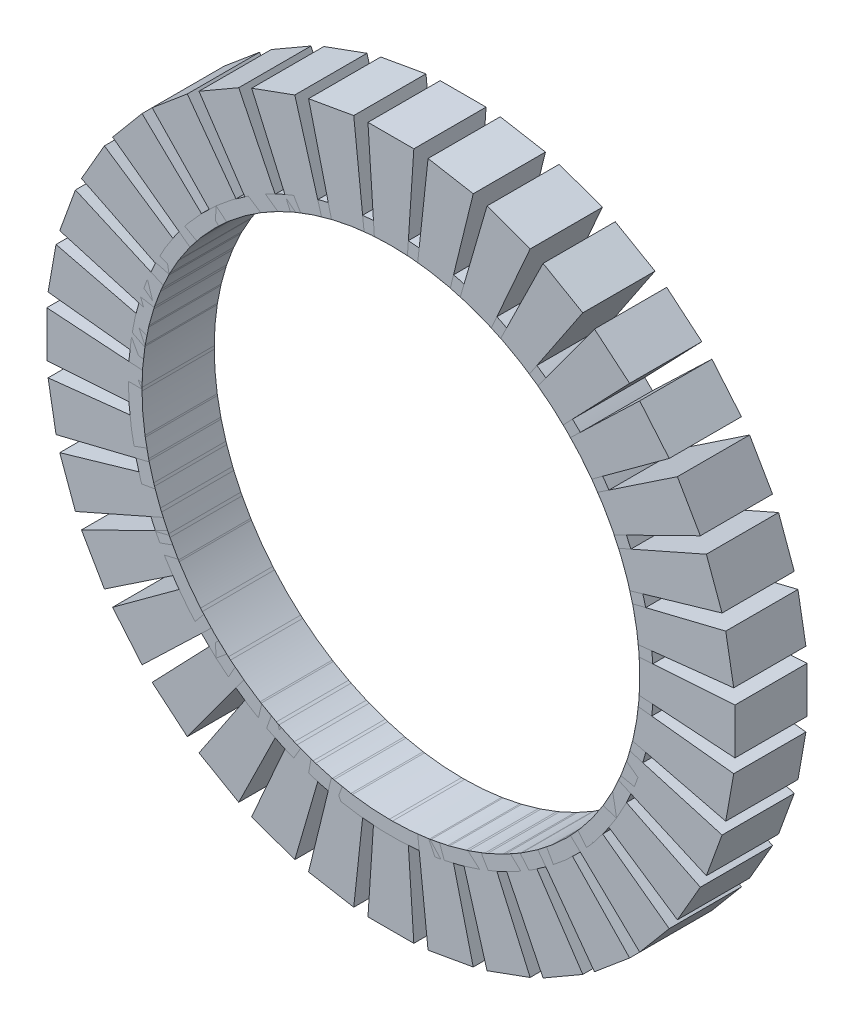
from build123d import *

# Parameters (mm, degrees)
BOSS_EXTRUDE1_DEPTH    = 4.25
BOSS_EXTRUDE1_2_DEPTH  = 4.25
BOSS_EXTRUDE1_3_DEPTH  = 4.25
BOSS_EXTRUDE1_4_DEPTH  = 4.25
BOSS_EXTRUDE1_5_DEPTH  = 4.25
BOSS_EXTRUDE1_6_DEPTH  = 4.25
BOSS_EXTRUDE1_7_DEPTH  = 4.25
BOSS_EXTRUDE1_8_DEPTH  = 4.25
BOSS_EXTRUDE1_9_DEPTH  = 4.25
BOSS_EXTRUDE1_10_DEPTH = 4.25
BOSS_EXTRUDE1_11_DEPTH = 4.25
BOSS_EXTRUDE1_12_DEPTH = 4.25
BOSS_EXTRUDE1_13_DEPTH = 4.25
BOSS_EXTRUDE1_14_DEPTH = 4.25
BOSS_EXTRUDE1_15_DEPTH = 4.25
BOSS_EXTRUDE1_16_DEPTH = 4.25
BOSS_EXTRUDE1_17_DEPTH = 4.25
BOSS_EXTRUDE1_18_DEPTH = 4.25
BOSS_EXTRUDE1_19_DEPTH = 4.25
BOSS_EXTRUDE1_20_DEPTH = 4.25
BOSS_EXTRUDE1_21_DEPTH = 4.25
BOSS_EXTRUDE1_22_DEPTH = 4.25
BOSS_EXTRUDE1_23_DEPTH = 4.25
BOSS_EXTRUDE1_24_DEPTH = 4.25
BOSS_EXTRUDE1_25_DEPTH = 4.25
BOSS_EXTRUDE1_26_DEPTH = 4.25
BOSS_EXTRUDE1_27_DEPTH = 4.25
BOSS_EXTRUDE1_28_DEPTH = 4.25
BOSS_EXTRUDE1_29_DEPTH = 4.25
BOSS_EXTRUDE1_30_DEPTH = 4.25
BOSS_EXTRUDE1_31_DEPTH = 4.25
BOSS_EXTRUDE1_32_DEPTH = 4.25
BOSS_EXTRUDE1_33_DEPTH = 4.25
BOSS_EXTRUDE1_34_DEPTH = 4.25
BOSS_EXTRUDE1_35_DEPTH = 4.25
BOSS_EXTRUDE1_36_DEPTH = 4.25
SKETCH2_R              = 30.9
SKETCH2_R_2            = 29.3
BOSS_EXTRUDE2_DEPTH    = 4.25


with BuildPart() as part:
    # Sketch1 → Boss-Extrude1 (new, symmetric)
    with BuildSketch(Plane.XY):
        with BuildLine():
            Line((-2.7, 40.5), (2.7, 40.5))
            Line((2.7, 40.5), (1.949007008, 29.235105125))
            ThreePointArc((1.949007008, 29.235105125), (0, 29.3), (-1.949007008, 29.235105125))
            Line((-1.949007008, 29.235105125), (-2.7, 40.5))
        make_face()
    extrude(amount=BOSS_EXTRUDE1_DEPTH, both=True)


with BuildPart() as body_2:
    # Sketch1 → Boss-Extrude1 2 (new, symmetric)
    with BuildSketch(Plane.XY):
        with BuildLine():
            Line((3.157225516, 29.129399703), (4.373770262, 40.353564077))
            Line((4.373770262, 40.353564077), (9.691732129, 39.415863917))
            Line((9.691732129, 39.415863917), (6.996019941, 28.452516672))
            ThreePointArc((6.996019941, 28.452516672), (5.087891606, 28.854867163), (3.157225516, 29.129399703))
        make_face()
    extrude(amount=BOSS_EXTRUDE1_2_DEPTH, both=True)


with BuildPart() as body_3:
    # Sketch1 → Boss-Extrude1 3 (new, symmetric)
    with BuildSketch(Plane.XY):
        with BuildLine():
            Line((8.167527341, 28.13861221), (11.314645729, 38.981005529))
            Line((11.314645729, 38.981005529), (16.388985881, 37.134096755))
            Line((16.388985881, 37.134096755), (11.830462349, 26.805412898))
            ThreePointArc((11.830462349, 26.805412898), (10.021190199, 27.532993789), (8.167527341, 28.13861221))
        make_face()
    extrude(amount=BOSS_EXTRUDE1_3_DEPTH, both=True)


with BuildPart() as body_4:
    # Sketch1 → Boss-Extrude1 4 (new, symmetric)
    with BuildSketch(Plane.XY):
        with BuildLine():
            Line((12.929662981, 26.292847225), (17.91173141, 36.424028853))
            Line((17.91173141, 36.424028853), (22.58826859, 33.724028853))
            Line((22.58826859, 33.724028853), (16.305442144, 24.343840217))
            ThreePointArc((16.305442144, 24.343840217), (14.65, 25.374544331), (12.929662981, 26.292847225))
        make_face()
    extrude(amount=BOSS_EXTRUDE1_4_DEPTH, both=True)


with BuildPart() as body_5:
    # Sketch1 → Boss-Extrude1 5 (new, symmetric)
    with BuildSketch(Plane.XY):
        with BuildLine():
            Line((17.298937354, 23.648187381), (23.964578196, 32.760326492))
            Line((23.964578196, 32.760326492), (28.101218189, 29.2892734))
            Line((28.101218189, 29.2892734), (20.284989331, 21.142592269))
            ThreePointArc((20.284989331, 21.142592269), (18.833676964, 22.445102183), (17.298937354, 23.648187381))
        make_face()
    extrude(amount=BOSS_EXTRUDE1_5_DEPTH, both=True)


with BuildPart() as body_6:
    # Sketch1 → Boss-Extrude1 6 (new, symmetric)
    with BuildSketch(Plane.XY):
        with BuildLine():
            Line((21.142592269, 20.284989331), (29.2892734, 28.101218189))
            Line((29.2892734, 28.101218189), (32.760326492, 23.964578196))
            Line((32.760326492, 23.964578196), (23.648187381, 17.298937354))
            ThreePointArc((23.648187381, 17.298937354), (22.445102183, 18.833676964), (21.142592269, 20.284989331))
        make_face()
    extrude(amount=BOSS_EXTRUDE1_6_DEPTH, both=True)


with BuildPart() as body_7:
    # Sketch1 → Boss-Extrude1 7 (new, symmetric)
    with BuildSketch(Plane.XY):
        with BuildLine():
            Line((24.343840217, 16.305442144), (33.724028853, 22.58826859))
            Line((33.724028853, 22.58826859), (36.424028853, 17.91173141))
            Line((36.424028853, 17.91173141), (26.292847225, 12.929662981))
            ThreePointArc((26.292847225, 12.929662981), (25.374544331, 14.65), (24.343840217, 16.305442144))
        make_face()
    extrude(amount=BOSS_EXTRUDE1_7_DEPTH, both=True)


with BuildPart() as body_8:
    # Sketch1 → Boss-Extrude1 8 (new, symmetric)
    with BuildSketch(Plane.XY):
        with BuildLine():
            Line((26.805412898, 11.830462349), (37.134096755, 16.388985881))
            Line((37.134096755, 16.388985881), (38.981005529, 11.314645729))
            Line((38.981005529, 11.314645729), (28.13861221, 8.167527341))
            ThreePointArc((28.13861221, 8.167527341), (27.532993789, 10.021190199), (26.805412898, 11.830462349))
        make_face()
    extrude(amount=BOSS_EXTRUDE1_8_DEPTH, both=True)


with BuildPart() as body_9:
    # Sketch1 → Boss-Extrude1 9 (new, symmetric)
    with BuildSketch(Plane.XY):
        with BuildLine():
            Line((28.452516672, 6.996019941), (39.415863917, 9.691732129))
            Line((39.415863917, 9.691732129), (40.353564077, 4.373770262))
            Line((40.353564077, 4.373770262), (29.129399703, 3.157225516))
            ThreePointArc((29.129399703, 3.157225516), (28.854867163, 5.087891606), (28.452516672, 6.996019941))
        make_face()
    extrude(amount=BOSS_EXTRUDE1_9_DEPTH, both=True)


with BuildPart() as body_10:
    # Sketch1 → Boss-Extrude1 10 (new, symmetric)
    with BuildSketch(Plane.XY):
        with BuildLine():
            Line((29.235105125, 1.949007008), (40.5, 2.7))
            Line((40.5, 2.7), (40.5, -2.7))
            Line((40.5, -2.7), (29.235105125, -1.949007008))
            ThreePointArc((29.235105125, -1.949007008), (29.3, 0), (29.235105125, 1.949007008))
        make_face()
    extrude(amount=BOSS_EXTRUDE1_10_DEPTH, both=True)


with BuildPart() as body_11:
    # Sketch1 → Boss-Extrude1 11 (new, symmetric)
    with BuildSketch(Plane.XY):
        with BuildLine():
            Line((29.129399703, -3.157225516), (40.353564077, -4.373770262))
            Line((40.353564077, -4.373770262), (39.415863917, -9.691732129))
            Line((39.415863917, -9.691732129), (28.452516672, -6.996019941))
            ThreePointArc((28.452516672, -6.996019941), (28.854867163, -5.087891606), (29.129399703, -3.157225516))
        make_face()
    extrude(amount=BOSS_EXTRUDE1_11_DEPTH, both=True)


with BuildPart() as body_12:
    # Sketch1 → Boss-Extrude1 12 (new, symmetric)
    with BuildSketch(Plane.XY):
        with BuildLine():
            Line((28.13861221, -8.167527341), (38.981005529, -11.314645729))
            Line((38.981005529, -11.314645729), (37.134096755, -16.388985881))
            Line((37.134096755, -16.388985881), (26.805412898, -11.830462349))
            ThreePointArc((26.805412898, -11.830462349), (27.532993789, -10.021190199), (28.13861221, -8.167527341))
        make_face()
    extrude(amount=BOSS_EXTRUDE1_12_DEPTH, both=True)


with BuildPart() as body_13:
    # Sketch1 → Boss-Extrude1 13 (new, symmetric)
    with BuildSketch(Plane.XY):
        with BuildLine():
            Line((26.292847225, -12.929662981), (36.424028853, -17.91173141))
            Line((36.424028853, -17.91173141), (33.724028853, -22.58826859))
            Line((33.724028853, -22.58826859), (24.343840217, -16.305442144))
            ThreePointArc((24.343840217, -16.305442144), (25.374544331, -14.65), (26.292847225, -12.929662981))
        make_face()
    extrude(amount=BOSS_EXTRUDE1_13_DEPTH, both=True)


with BuildPart() as body_14:
    # Sketch1 → Boss-Extrude1 14 (new, symmetric)
    with BuildSketch(Plane.XY):
        with BuildLine():
            Line((23.648187381, -17.298937354), (32.760326492, -23.964578196))
            Line((32.760326492, -23.964578196), (29.2892734, -28.101218189))
            Line((29.2892734, -28.101218189), (21.142592269, -20.284989331))
            ThreePointArc((21.142592269, -20.284989331), (22.445102183, -18.833676964), (23.648187381, -17.298937354))
        make_face()
    extrude(amount=BOSS_EXTRUDE1_14_DEPTH, both=True)


with BuildPart() as body_15:
    # Sketch1 → Boss-Extrude1 15 (new, symmetric)
    with BuildSketch(Plane.XY):
        with BuildLine():
            Line((20.284989331, -21.142592269), (28.101218189, -29.2892734))
            Line((28.101218189, -29.2892734), (23.964578196, -32.760326492))
            Line((23.964578196, -32.760326492), (17.298937354, -23.648187381))
            ThreePointArc((17.298937354, -23.648187381), (18.833676964, -22.445102183), (20.284989331, -21.142592269))
        make_face()
    extrude(amount=BOSS_EXTRUDE1_15_DEPTH, both=True)


with BuildPart() as body_16:
    # Sketch1 → Boss-Extrude1 16 (new, symmetric)
    with BuildSketch(Plane.XY):
        with BuildLine():
            Line((16.305442144, -24.343840217), (22.58826859, -33.724028853))
            Line((22.58826859, -33.724028853), (17.91173141, -36.424028853))
            Line((17.91173141, -36.424028853), (12.929662981, -26.292847225))
            ThreePointArc((12.929662981, -26.292847225), (14.65, -25.374544331), (16.305442144, -24.343840217))
        make_face()
    extrude(amount=BOSS_EXTRUDE1_16_DEPTH, both=True)


with BuildPart() as body_17:
    # Sketch1 → Boss-Extrude1 17 (new, symmetric)
    with BuildSketch(Plane.XY):
        with BuildLine():
            Line((11.830462349, -26.805412898), (16.388985881, -37.134096755))
            Line((16.388985881, -37.134096755), (11.314645729, -38.981005529))
            Line((11.314645729, -38.981005529), (8.167527341, -28.13861221))
            ThreePointArc((8.167527341, -28.13861221), (10.021190199, -27.532993789), (11.830462349, -26.805412898))
        make_face()
    extrude(amount=BOSS_EXTRUDE1_17_DEPTH, both=True)


with BuildPart() as body_18:
    # Sketch1 → Boss-Extrude1 18 (new, symmetric)
    with BuildSketch(Plane.XY):
        with BuildLine():
            Line((6.996019941, -28.452516672), (9.691732129, -39.415863917))
            Line((9.691732129, -39.415863917), (4.373770262, -40.353564077))
            Line((4.373770262, -40.353564077), (3.157225516, -29.129399703))
            ThreePointArc((3.157225516, -29.129399703), (5.087891606, -28.854867163), (6.996019941, -28.452516672))
        make_face()
    extrude(amount=BOSS_EXTRUDE1_18_DEPTH, both=True)


with BuildPart() as body_19:
    # Sketch1 → Boss-Extrude1 19 (new, symmetric)
    with BuildSketch(Plane.XY):
        with BuildLine():
            Line((1.949007008, -29.235105125), (2.7, -40.5))
            Line((2.7, -40.5), (-2.7, -40.5))
            Line((-2.7, -40.5), (-1.949007008, -29.235105125))
            ThreePointArc((-1.949007008, -29.235105125), (0, -29.3), (1.949007008, -29.235105125))
        make_face()
    extrude(amount=BOSS_EXTRUDE1_19_DEPTH, both=True)


with BuildPart() as body_20:
    # Sketch1 → Boss-Extrude1 20 (new, symmetric)
    with BuildSketch(Plane.XY):
        with BuildLine():
            Line((-3.157225516, -29.129399703), (-4.373770262, -40.353564077))
            Line((-4.373770262, -40.353564077), (-9.691732129, -39.415863917))
            Line((-9.691732129, -39.415863917), (-6.996019941, -28.452516672))
            ThreePointArc((-6.996019941, -28.452516672), (-5.087891606, -28.854867163), (-3.157225516, -29.129399703))
        make_face()
    extrude(amount=BOSS_EXTRUDE1_20_DEPTH, both=True)


with BuildPart() as body_21:
    # Sketch1 → Boss-Extrude1 21 (new, symmetric)
    with BuildSketch(Plane.XY):
        with BuildLine():
            Line((-8.167527341, -28.13861221), (-11.314645729, -38.981005529))
            Line((-11.314645729, -38.981005529), (-16.388985881, -37.134096755))
            Line((-16.388985881, -37.134096755), (-11.830462349, -26.805412898))
            ThreePointArc((-11.830462349, -26.805412898), (-10.021190199, -27.532993789), (-8.167527341, -28.13861221))
        make_face()
    extrude(amount=BOSS_EXTRUDE1_21_DEPTH, both=True)


with BuildPart() as body_22:
    # Sketch1 → Boss-Extrude1 22 (new, symmetric)
    with BuildSketch(Plane.XY):
        with BuildLine():
            Line((-12.929662981, -26.292847225), (-17.91173141, -36.424028853))
            Line((-17.91173141, -36.424028853), (-22.58826859, -33.724028853))
            Line((-22.58826859, -33.724028853), (-16.305442144, -24.343840217))
            ThreePointArc((-16.305442144, -24.343840217), (-14.65, -25.374544331), (-12.929662981, -26.292847225))
        make_face()
    extrude(amount=BOSS_EXTRUDE1_22_DEPTH, both=True)


with BuildPart() as body_23:
    # Sketch1 → Boss-Extrude1 23 (new, symmetric)
    with BuildSketch(Plane.XY):
        with BuildLine():
            Line((-17.298937354, -23.648187381), (-23.964578196, -32.760326492))
            Line((-23.964578196, -32.760326492), (-28.101218189, -29.2892734))
            Line((-28.101218189, -29.2892734), (-20.284989331, -21.142592269))
            ThreePointArc((-20.284989331, -21.142592269), (-18.833676964, -22.445102183), (-17.298937354, -23.648187381))
        make_face()
    extrude(amount=BOSS_EXTRUDE1_23_DEPTH, both=True)


with BuildPart() as body_24:
    # Sketch1 → Boss-Extrude1 24 (new, symmetric)
    with BuildSketch(Plane.XY):
        with BuildLine():
            Line((-21.142592269, -20.284989331), (-29.2892734, -28.101218189))
            Line((-29.2892734, -28.101218189), (-32.760326492, -23.964578196))
            Line((-32.760326492, -23.964578196), (-23.648187381, -17.298937354))
            ThreePointArc((-23.648187381, -17.298937354), (-22.445102183, -18.833676964), (-21.142592269, -20.284989331))
        make_face()
    extrude(amount=BOSS_EXTRUDE1_24_DEPTH, both=True)


with BuildPart() as body_25:
    # Sketch1 → Boss-Extrude1 25 (new, symmetric)
    with BuildSketch(Plane.XY):
        with BuildLine():
            Line((-24.343840217, -16.305442144), (-33.724028853, -22.58826859))
            Line((-33.724028853, -22.58826859), (-36.424028853, -17.91173141))
            Line((-36.424028853, -17.91173141), (-26.292847225, -12.929662981))
            ThreePointArc((-26.292847225, -12.929662981), (-25.374544331, -14.65), (-24.343840217, -16.305442144))
        make_face()
    extrude(amount=BOSS_EXTRUDE1_25_DEPTH, both=True)


with BuildPart() as body_26:
    # Sketch1 → Boss-Extrude1 26 (new, symmetric)
    with BuildSketch(Plane.XY):
        with BuildLine():
            Line((-26.805412898, -11.830462349), (-37.134096755, -16.388985881))
            Line((-37.134096755, -16.388985881), (-38.981005529, -11.314645729))
            Line((-38.981005529, -11.314645729), (-28.13861221, -8.167527341))
            ThreePointArc((-28.13861221, -8.167527341), (-27.532993789, -10.021190199), (-26.805412898, -11.830462349))
        make_face()
    extrude(amount=BOSS_EXTRUDE1_26_DEPTH, both=True)


with BuildPart() as body_27:
    # Sketch1 → Boss-Extrude1 27 (new, symmetric)
    with BuildSketch(Plane.XY):
        with BuildLine():
            Line((-28.452516672, -6.996019941), (-39.415863917, -9.691732129))
            Line((-39.415863917, -9.691732129), (-40.353564077, -4.373770262))
            Line((-40.353564077, -4.373770262), (-29.129399703, -3.157225516))
            ThreePointArc((-29.129399703, -3.157225516), (-28.854867163, -5.087891606), (-28.452516672, -6.996019941))
        make_face()
    extrude(amount=BOSS_EXTRUDE1_27_DEPTH, both=True)


with BuildPart() as body_28:
    # Sketch1 → Boss-Extrude1 28 (new, symmetric)
    with BuildSketch(Plane.XY):
        with BuildLine():
            Line((-29.235105125, -1.949007008), (-40.5, -2.7))
            Line((-40.5, -2.7), (-40.5, 2.7))
            Line((-40.5, 2.7), (-29.235105125, 1.949007008))
            ThreePointArc((-29.235105125, 1.949007008), (-29.3, 0), (-29.235105125, -1.949007008))
        make_face()
    extrude(amount=BOSS_EXTRUDE1_28_DEPTH, both=True)


with BuildPart() as body_29:
    # Sketch1 → Boss-Extrude1 29 (new, symmetric)
    with BuildSketch(Plane.XY):
        with BuildLine():
            Line((-29.129399703, 3.157225516), (-40.353564077, 4.373770262))
            Line((-40.353564077, 4.373770262), (-39.415863917, 9.691732129))
            Line((-39.415863917, 9.691732129), (-28.452516672, 6.996019941))
            ThreePointArc((-28.452516672, 6.996019941), (-28.854867163, 5.087891606), (-29.129399703, 3.157225516))
        make_face()
    extrude(amount=BOSS_EXTRUDE1_29_DEPTH, both=True)


with BuildPart() as body_30:
    # Sketch1 → Boss-Extrude1 30 (new, symmetric)
    with BuildSketch(Plane.XY):
        with BuildLine():
            Line((-28.13861221, 8.167527341), (-38.981005529, 11.314645729))
            Line((-38.981005529, 11.314645729), (-37.134096755, 16.388985881))
            Line((-37.134096755, 16.388985881), (-26.805412898, 11.830462349))
            ThreePointArc((-26.805412898, 11.830462349), (-27.532993789, 10.021190199), (-28.13861221, 8.167527341))
        make_face()
    extrude(amount=BOSS_EXTRUDE1_30_DEPTH, both=True)


with BuildPart() as body_31:
    # Sketch1 → Boss-Extrude1 31 (new, symmetric)
    with BuildSketch(Plane.XY):
        with BuildLine():
            Line((-26.292847225, 12.929662981), (-36.424028853, 17.91173141))
            Line((-36.424028853, 17.91173141), (-33.724028853, 22.58826859))
            Line((-33.724028853, 22.58826859), (-24.343840217, 16.305442144))
            ThreePointArc((-24.343840217, 16.305442144), (-25.374544331, 14.65), (-26.292847225, 12.929662981))
        make_face()
    extrude(amount=BOSS_EXTRUDE1_31_DEPTH, both=True)


with BuildPart() as body_32:
    # Sketch1 → Boss-Extrude1 32 (new, symmetric)
    with BuildSketch(Plane.XY):
        with BuildLine():
            Line((-23.648187381, 17.298937354), (-32.760326492, 23.964578196))
            Line((-32.760326492, 23.964578196), (-29.2892734, 28.101218189))
            Line((-29.2892734, 28.101218189), (-21.142592269, 20.284989331))
            ThreePointArc((-21.142592269, 20.284989331), (-22.445102183, 18.833676964), (-23.648187381, 17.298937354))
        make_face()
    extrude(amount=BOSS_EXTRUDE1_32_DEPTH, both=True)


with BuildPart() as body_33:
    # Sketch1 → Boss-Extrude1 33 (new, symmetric)
    with BuildSketch(Plane.XY):
        with BuildLine():
            Line((-20.284989331, 21.142592269), (-28.101218189, 29.2892734))
            Line((-28.101218189, 29.2892734), (-23.964578196, 32.760326492))
            Line((-23.964578196, 32.760326492), (-17.298937354, 23.648187381))
            ThreePointArc((-17.298937354, 23.648187381), (-18.833676964, 22.445102183), (-20.284989331, 21.142592269))
        make_face()
    extrude(amount=BOSS_EXTRUDE1_33_DEPTH, both=True)


with BuildPart() as body_34:
    # Sketch1 → Boss-Extrude1 34 (new, symmetric)
    with BuildSketch(Plane.XY):
        with BuildLine():
            Line((-16.305442144, 24.343840217), (-22.58826859, 33.724028853))
            Line((-22.58826859, 33.724028853), (-17.91173141, 36.424028853))
            Line((-17.91173141, 36.424028853), (-12.929662981, 26.292847225))
            ThreePointArc((-12.929662981, 26.292847225), (-14.65, 25.374544331), (-16.305442144, 24.343840217))
        make_face()
    extrude(amount=BOSS_EXTRUDE1_34_DEPTH, both=True)


with BuildPart() as body_35:
    # Sketch1 → Boss-Extrude1 35 (new, symmetric)
    with BuildSketch(Plane.XY):
        with BuildLine():
            Line((-11.830462349, 26.805412898), (-16.388985881, 37.134096755))
            Line((-16.388985881, 37.134096755), (-11.314645729, 38.981005529))
            Line((-11.314645729, 38.981005529), (-8.167527341, 28.13861221))
            ThreePointArc((-8.167527341, 28.13861221), (-10.021190199, 27.532993789), (-11.830462349, 26.805412898))
        make_face()
    extrude(amount=BOSS_EXTRUDE1_35_DEPTH, both=True)


with BuildPart() as body_36:
    # Sketch1 → Boss-Extrude1 36 (new, symmetric)
    with BuildSketch(Plane.XY):
        with BuildLine():
            Line((-6.996019941, 28.452516672), (-9.691732129, 39.415863917))
            Line((-9.691732129, 39.415863917), (-4.373770262, 40.353564077))
            Line((-4.373770262, 40.353564077), (-3.157225516, 29.129399703))
            ThreePointArc((-3.157225516, 29.129399703), (-5.087891606, 28.854867163), (-6.996019941, 28.452516672))
        make_face()
    extrude(amount=BOSS_EXTRUDE1_36_DEPTH, both=True)


with BuildPart() as body_37:
    # Sketch2 → Boss-Extrude2 (new, symmetric)
    with BuildSketch(Plane.XY):
        Circle(SKETCH2_R)
        Circle(SKETCH2_R_2, mode=Mode.SUBTRACT)
    extrude(amount=BOSS_EXTRUDE2_DEPTH, both=True)


solid = Compound([part.part, body_2.part, body_3.part, body_4.part, body_5.part, body_6.part, body_7.part, body_8.part, body_9.part, body_10.part, body_11.part, body_12.part, body_13.part, body_14.part, body_15.part, body_16.part, body_17.part, body_18.part, body_19.part, body_20.part, body_21.part, body_22.part, body_23.part, body_24.part, body_25.part, body_26.part, body_27.part, body_28.part, body_29.part, body_30.part, body_31.part, body_32.part, body_33.part, body_34.part, body_35.part, body_36.part, body_37.part])
